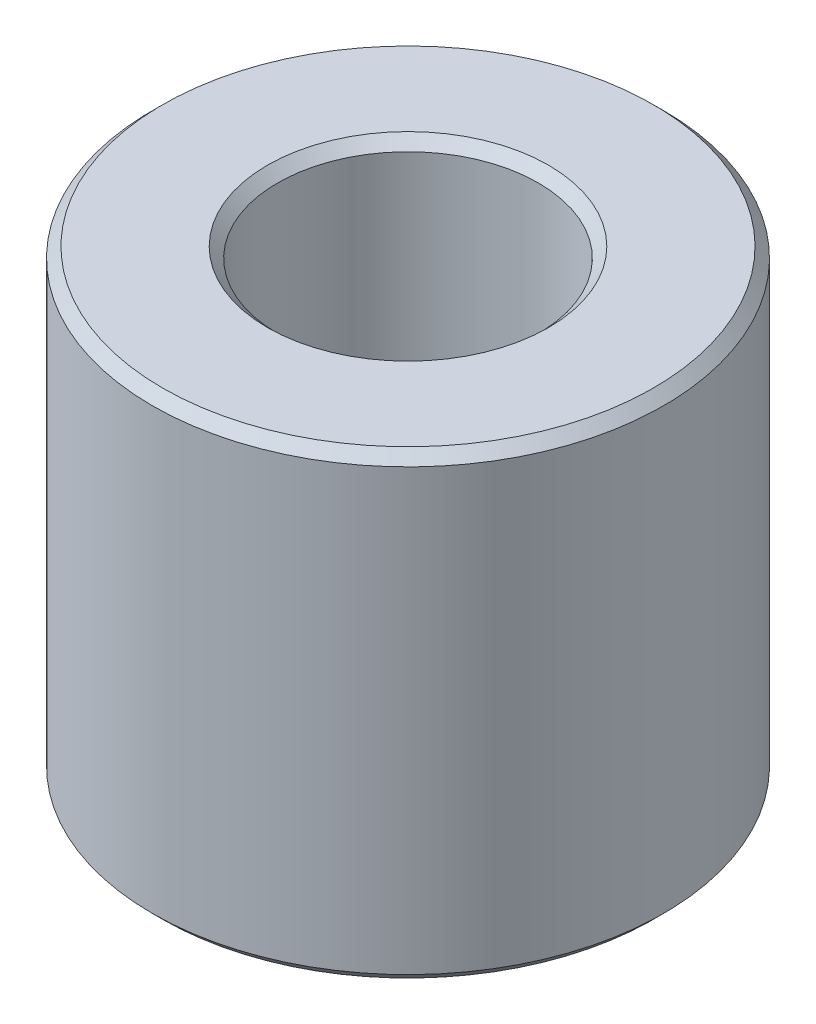
from build123d import *


with BuildPart() as part:
    # Sketch1 → Revolve1 (revolve)
    with BuildSketch(Plane(origin=(0, 0, 0), x_dir=(0, 0, -1), z_dir=(1, 0, 0)), mode=Mode.PRIVATE) as revolve1_sk:
        Polygon((2.55, 4.3), (2.75, 4.5), (4.8, 4.5), (5, 4.3), (5, -4.3), (4.8, -4.5), (2.75, -4.5), (2.55, -4.3), align=None)
    revolve(revolve1_sk.sketch.rotate(Axis((0, 2.133870968, 0), (0, -1, 0)), 180), axis=Axis((0, 2.133870968, 0), (0, -1, 0)))


solid = part.part
